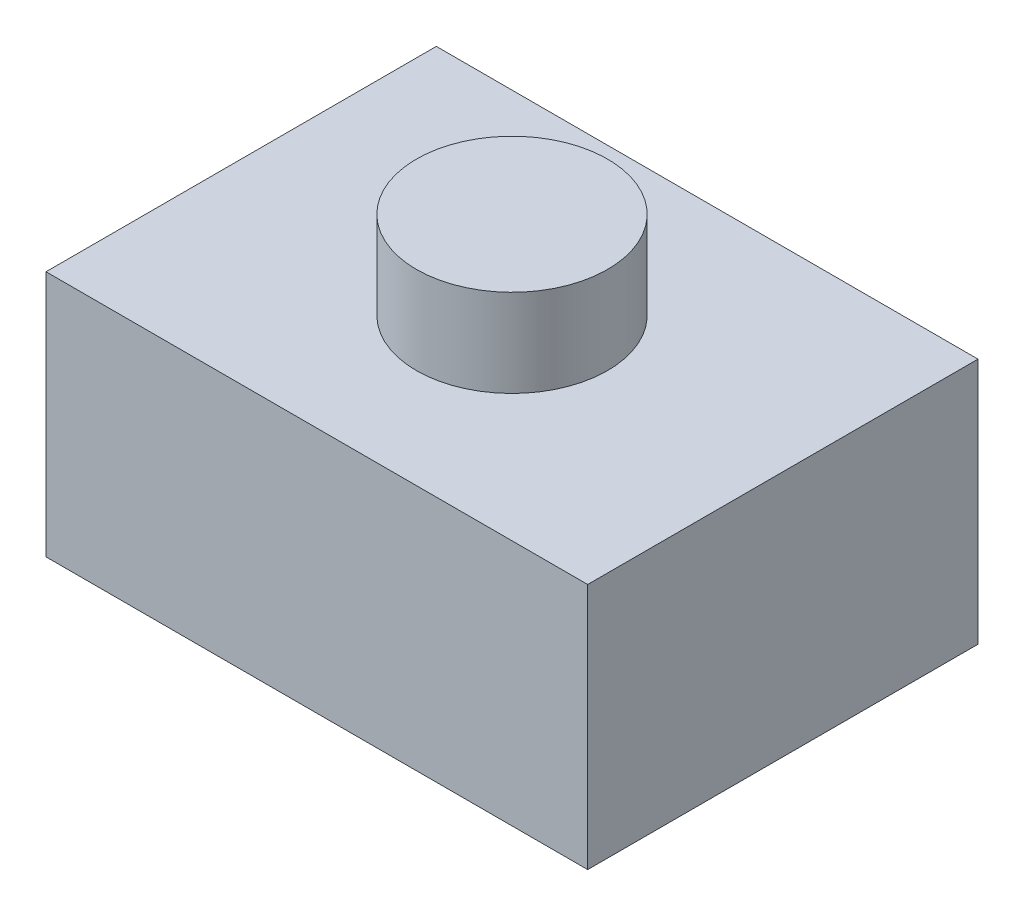
from build123d import *

# Parameters (mm, degrees)
SKETCH_1_W      = 34
SKETCH_1_H      = 24.5
EXTRUDE_1_DEPTH = 15.5
SKETCH_2_R      = 6
EXTRUDE_2_DEPTH = 5.5


with BuildPart() as part:
    # 草图1 → 凸台-拉伸1 (new body)
    with BuildSketch(Plane(origin=(0, 0, 0), x_dir=(1, 0, 0), z_dir=(0, 1, 0))):
        with Locations((-17, 12.25)):
            Rectangle(SKETCH_1_W, SKETCH_1_H)
    extrude(amount=EXTRUDE_1_DEPTH)

    # 草图2 → 凸台-拉伸2 (add)
    with BuildSketch(Plane(origin=(0, 15.5, 0), x_dir=(1, 0, 0), z_dir=(0, 1, 0))):
        with Locations(Location((-17, 12.25, 0), (0, 0, 270))):
            Circle(SKETCH_2_R)
    extrude(amount=EXTRUDE_2_DEPTH)


solid = part.part
